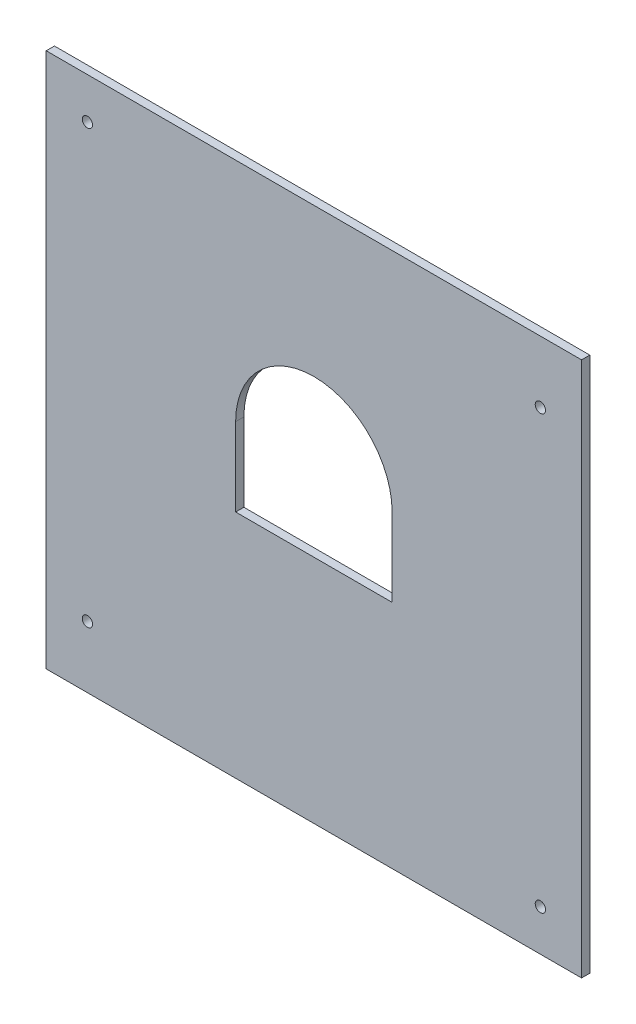
from build123d import *

# Parameters (mm, degrees)
SKETCH_1_W      = 130
SKETCH_1_H      = 130
SKETCH_1_R      = 1.25
EXTRUDE_1_DEPTH = 2


with BuildPart() as part:
    # Эскиз1 → Бобышка-Вытянуть1 (new body)
    with BuildSketch(Plane.XY):
        Rectangle(SKETCH_1_W, SKETCH_1_H)
        with Locations((-55, 55)):
            Circle(SKETCH_1_R, mode=Mode.SUBTRACT)
        with Locations((55, 50)):
            Circle(SKETCH_1_R, mode=Mode.SUBTRACT)
        with Locations((55, -55)):
            Circle(SKETCH_1_R, mode=Mode.SUBTRACT)
        with Locations((-55, -50)):
            Circle(SKETCH_1_R, mode=Mode.SUBTRACT)
        with BuildLine():
            Line((-18.999998719, 10.000001538), (-18.999998719, -9.000007164))
            Line((-18.999998719, -9.000007164), (19.000000929, -9.000007164))
            Line((19.000000929, -9.000007164), (19.000000929, 10.000001538))
            ThreePointArc((19.000000929, 10.000001538), (1.105e-06, 29.000001361), (-18.999998719, 10.000001538))
        make_face(mode=Mode.SUBTRACT)
    extrude(amount=EXTRUDE_1_DEPTH)


solid = part.part
